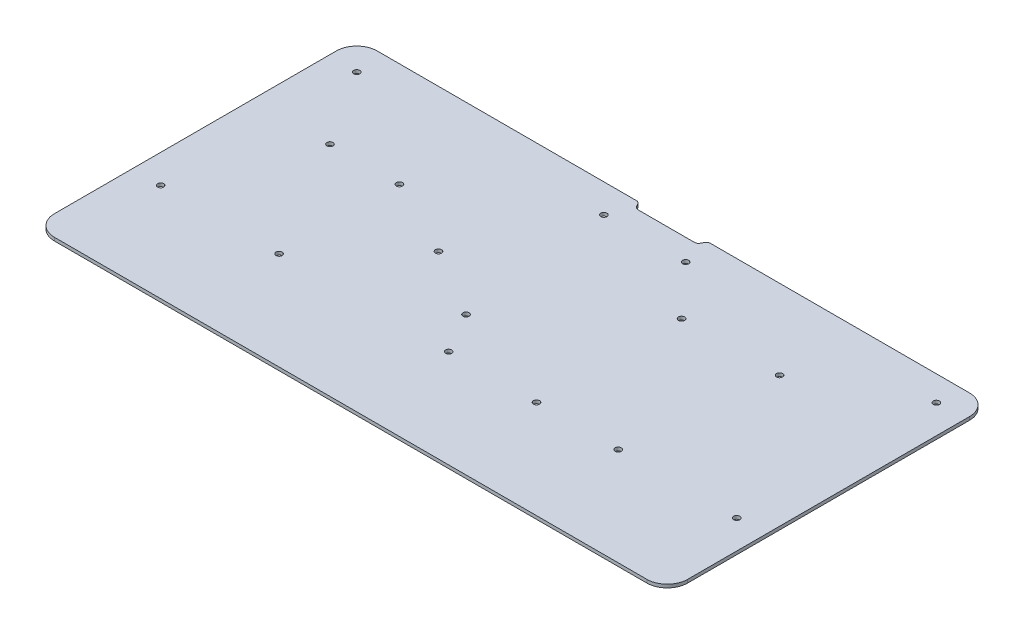
from build123d import *

# Parameters (mm, degrees)
SKETCH_1_R      = 1.5
EXTRUDE_1_DEPTH = 1.6


with BuildPart() as part:
    # 草图1 → 凸台-拉伸1 (new body)
    with BuildSketch(Plane(origin=(0, 0, 0), x_dir=(1, 0, 0), z_dir=(0, 1, 0))):
        with BuildLine():
            Line((10, 0), (136.884360712, 0))
            ThreePointArc((136.884360712, 0), (137.900113715, -0.277140216), (138.634360712, -1.031754163))
            Line((138.634360712, -1.031754163), (139.429147615, -2.468245837))
            ThreePointArc((139.429147615, -2.468245837), (140.163394612, -3.222859784), (141.179147615, -3.5))
            Line((141.179147615, -3.5), (143.5, -3.5))
            Line((143.5, -3.5), (166.5, -3.5))
            Line((166.5, -3.5), (168.820852385, -3.5))
            ThreePointArc((168.820852385, -3.5), (169.836605388, -3.222859784), (170.570852385, -2.468245837))
            Line((170.570852385, -2.468245837), (171.365639288, -1.031754163))
            ThreePointArc((171.365639288, -1.031754163), (172.099886285, -0.277140216), (173.115639288, 0))
            Line((173.115639288, 0), (300, 0))
            ThreePointArc((300, 0), (307.071067812, -2.928932188), (310, -10))
            Line((310, -10), (310, -148))
            ThreePointArc((310, -148), (307.071067812, -155.071067812), (300, -158))
            Line((300, -158), (10, -158))
            ThreePointArc((10, -158), (2.928932188, -155.071067812), (0, -148))
            Line((0, -148), (0, -10))
            ThreePointArc((0, -10), (2.928932188, -2.928932188), (10, 0))
        make_face()
        with Locations(Location((14, -14, 0), (0, 0, 270))):
            Circle(SKETCH_1_R, mode=Mode.SUBTRACT)
        with Locations(Location((296, -12.28568254, 0), (0, 0, 270))):
            Circle(SKETCH_1_R, mode=Mode.SUBTRACT)
        with Locations(Location((175, -14, 0), (0, 0, 270))):
            Circle(SKETCH_1_R, mode=Mode.SUBTRACT)
        with Locations(Location((135, -14, 0), (0, 0, 270))):
            Circle(SKETCH_1_R, mode=Mode.SUBTRACT)
        with Locations(Location((296, -110, 0), (0, 0, 270))):
            Circle(SKETCH_1_R, mode=Mode.SUBTRACT)
        with Locations(Location((14, -110, 0), (0, 0, 270))):
            Circle(SKETCH_1_R, mode=Mode.SUBTRACT)
        with Locations(Location((155, -110, 0), (0, 0, 270))):
            Circle(SKETCH_1_R, mode=Mode.SUBTRACT)
        with Locations(Location((72, -110, 0), (0, 0, 270))):
            Circle(SKETCH_1_R, mode=Mode.SUBTRACT)
        with Locations(Location((72, -51.096774194, 0), (0, 0, 270))):
            Circle(SKETCH_1_R, mode=Mode.SUBTRACT)
        with Locations(Location((238, -110, 0), (0, 0, 270))):
            Circle(SKETCH_1_R, mode=Mode.SUBTRACT)
        with Locations(Location((246, -39, 0), (0, 0, 270))):
            Circle(SKETCH_1_R, mode=Mode.SUBTRACT)
        with Locations(Location((198, -39, 0), (0, 0, 270))):
            Circle(SKETCH_1_R, mode=Mode.SUBTRACT)
        with Locations(Location((110, -70, 0), (0, 0, 270))):
            Circle(SKETCH_1_R, mode=Mode.SUBTRACT)
        with Locations(Location((38, -51.096774194, 0), (0, 0, 270))):
            Circle(SKETCH_1_R, mode=Mode.SUBTRACT)
        with Locations(Location((198, -110, 0), (0, 0, 270))):
            Circle(SKETCH_1_R, mode=Mode.SUBTRACT)
        with Locations(Location((143.5, -90, 0), (0, 0, 270))):
            Circle(SKETCH_1_R, mode=Mode.SUBTRACT)
    extrude(amount=EXTRUDE_1_DEPTH)


solid = part.part
